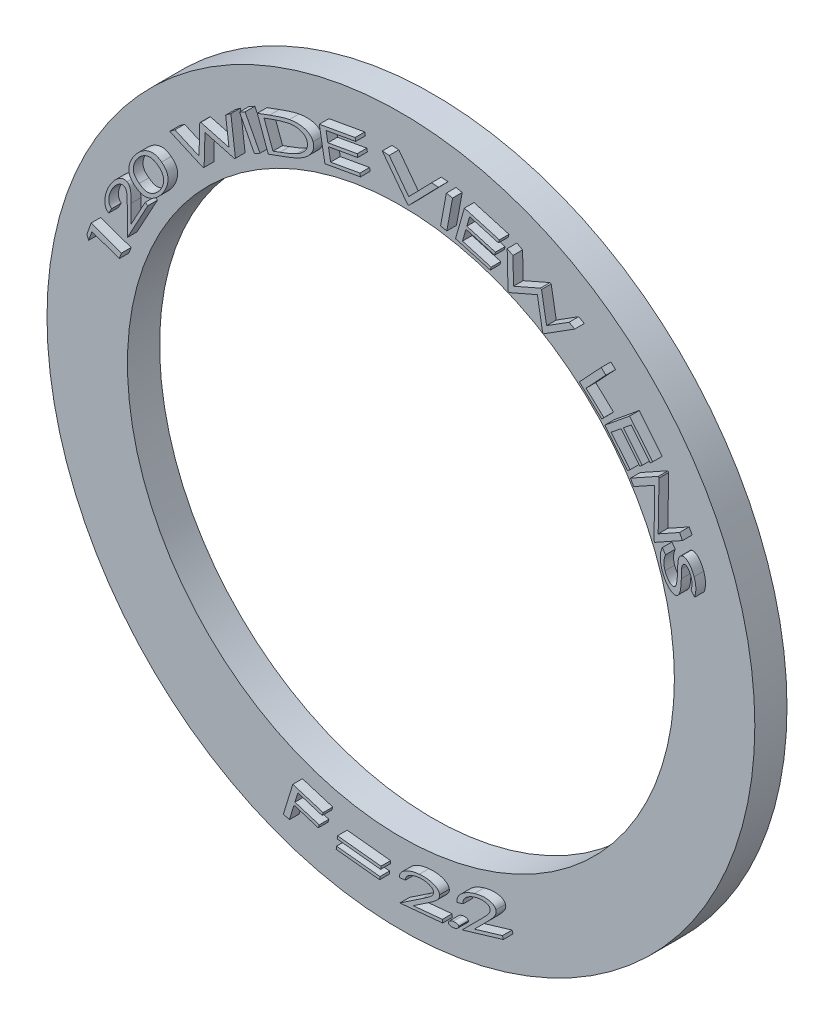
from build123d import *

# Parameters (mm, degrees)
DISC_PROFILE_R      = 11
DISC_EXTRUDE_DEPTH  = 1
LENS_HOLE_PROFILE_R = 8.5
LENS_HOLE_CUT_DEPTH = 16.588457268
LENS_TEXT_1_DEPTH   = 0.3
LENS_TEXT_2_DEPTH   = 0.3


with BuildPart() as part:
    # Disc Profile → Disc Extrude (new body)
    with BuildSketch(Plane.XY):
        Circle(DISC_PROFILE_R)
    extrude(amount=DISC_EXTRUDE_DEPTH)

    # Lens Hole Profile → Lens Hole Cut (cut, through all)
    with BuildSketch(Plane.XY.offset(1)):
        Circle(LENS_HOLE_PROFILE_R)
    extrude(amount=-LENS_HOLE_CUT_DEPTH, mode=Mode.SUBTRACT)

    # Lens Text 1 Profile → Lens Text 1 (add)
    # profile 1 of 15: a face of its own
    with BuildSketch(Plane.XY.offset(1)):
        with BuildLine():
            Line((8.423728617, 3.654576612), (8.527294322, 3.51315033))
            add(Edge.make_bspline(
                [(8.527294322, 3.51315033), (8.519780899, 3.494851602), (8.504980755, 3.458806267), (8.489407018, 3.403132009), (8.478491067, 3.347818082), (8.473602433, 3.292443154), (8.473594975, 3.237213772), (8.479720503, 3.182056578), (8.490393795, 3.126845698), (8.502132946, 3.090970139), (8.508063553, 3.072845843)],
                knots=[0, 0, 0, 0, 1.050343736, 2.068995719, 3.066212884, 4.042479059, 5.018261501, 5.995919489, 6.987540525, 8, 8, 8, 8], degree=3))
            add(Edge.make_bspline(
                [(8.508063553, 3.072845843), (8.513733128, 3.057537099), (8.524893765, 3.027401624), (8.544988036, 2.984201884), (8.566912667, 2.943195442), (8.591078398, 2.905204808), (8.616280961, 2.871097939), (8.641881761, 2.841909559), (8.667828569, 2.81831975), (8.693821097, 2.800366724), (8.719313465, 2.78769957), (8.743880411, 2.781245196), (8.767386402, 2.779236936), (8.781817692, 2.783224889), (8.788912912, 2.785185587)],
                knots=[0, 0, 0, 0, 1.353296211, 2.663982295, 3.94736361, 5.207015854, 6.394237166, 7.461098225, 8.421748881, 9.294144583, 10.074305401, 10.7673626, 11.393967334, 12, 12, 12, 12], degree=3))
            add(Edge.make_bspline(
                [(8.788912912, 2.785185587), (8.792782269, 2.78679854), (8.800574344, 2.79004669), (8.811340887, 2.797323925), (8.821404993, 2.806401989), (8.830670607, 2.817511675), (8.838839066, 2.830767879), (8.846358776, 2.845823755), (8.853527147, 2.862671994), (8.857143687, 2.874819637), (8.859025091, 2.881139112)],
                knots=[0, 0, 0, 0, 0.813988822, 1.639202765, 2.51319566, 3.444780499, 4.443274206, 5.535663917, 6.717997438, 8, 8, 8, 8], degree=3))
            add(Edge.make_bspline(
                [(8.859025091, 2.881139112), (8.861679224, 2.890994067), (8.867378796, 2.912156915), (8.873931558, 2.94671899), (8.879910185, 2.986009033), (8.885035023, 3.030112907), (8.889381802, 3.078944089), (8.892946694, 3.132577486), (8.895742833, 3.191014894), (8.896890388, 3.231630699), (8.897486629, 3.252733664)],
                knots=[0, 0, 0, 0, 0.654030667, 1.404486612, 2.253193904, 3.201411149, 4.250038705, 5.395470422, 6.646751032, 8, 8, 8, 8], degree=3))
            add(Edge.make_bspline(
                [(8.897486629, 3.252733664), (8.898139465, 3.273700775), (8.899384984, 3.313703063), (8.901390872, 3.370679555), (8.904352189, 3.421616085), (8.907112017, 3.466522038), (8.910808298, 3.505309931), (8.914435852, 3.538144969), (8.918632595, 3.564915334), (8.92231749, 3.580607064), (8.923928937, 3.58746924)],
                knots=[0, 0, 0, 0, 1.497309724, 2.856655588, 4.069078906, 5.139073161, 6.067665232, 6.849797215, 7.497002906, 8, 8, 8, 8], degree=3))
            add(Edge.make_bspline(
                [(8.923928937, 3.58746924), (8.926648496, 3.597197849), (8.931872597, 3.615885891), (8.941836528, 3.642116711), (8.953581985, 3.665213228), (8.966183163, 3.685738884), (8.980839171, 3.70287589), (8.996592339, 3.717367721), (9.013845795, 3.729117371), (9.026582678, 3.734190504), (9.032903296, 3.736708023)],
                knots=[0, 0, 0, 0, 1.259590594, 2.419593868, 3.492269597, 4.488089516, 5.4158305, 6.294262929, 7.153535963, 8, 8, 8, 8], degree=3))
            add(Edge.make_bspline(
                [(9.032903296, 3.736708023), (9.038013592, 3.738292335), (9.048232988, 3.741460588), (9.064121603, 3.744137621), (9.080328448, 3.744304119), (9.096829823, 3.743330505), (9.11356131, 3.739653173), (9.130644276, 3.734523383), (9.147965211, 3.727149883), (9.165512041, 3.717967402), (9.18309981, 3.706856956), (9.200708229, 3.694319143), (9.218099103, 3.679913965), (9.235214052, 3.663711315), (9.25222573, 3.645770497), (9.269346541, 3.626427012), (9.285914905, 3.605000209), (9.308209663, 3.574174943), (9.334653738, 3.532601932), (9.363694003, 3.479506361), (9.389958795, 3.422776834), (9.404633132, 3.383117329), (9.412110027, 3.362909946)],
                knots=[0, 0, 0, 0, 0.554757302, 1.10938483, 1.663752722, 2.23332095, 2.820234497, 3.435997283, 4.081848178, 4.769725298, 5.488611413, 6.238344157, 7.01090061, 7.829305935, 8.681858928, 9.575309961, 10.507944328, 11.490419604, 13.521623158, 15.614235795, 17.765357483, 20, 20, 20, 20], degree=3))
            add(Edge.make_bspline(
                [(9.412110027, 3.362909946), (9.419373553, 3.341169804), (9.433675819, 3.298362318), (9.449356178, 3.233351018), (9.460519098, 3.169196398), (9.465719706, 3.115812635), (9.467011163, 3.072920849), (9.466726555, 3.039823105), (9.464337477, 3.005752074), (9.460797487, 2.970658746), (9.455562488, 2.934571174), (9.448604765, 2.897466662), (9.440611373, 2.859234184), (9.433797366, 2.83363443), (9.430339194, 2.820642317)],
                knots=[0, 0, 0, 0, 1.49420363, 2.942165765, 4.356038615, 5.738248546, 6.435309068, 7.15385477, 7.895668277, 8.661726644, 9.453671682, 10.272746552, 11.123402835, 12, 12, 12, 12], degree=3))
            Line((9.430339194, 2.820642317), (9.318760668, 2.952052574))
            add(Edge.make_bspline(
                [(9.318760668, 2.952052574), (9.321340987, 2.962592589), (9.326375527, 2.983157538), (9.333005538, 3.013331208), (9.338432766, 3.041986369), (9.342712075, 3.0691033), (9.34567307, 3.094773919), (9.347760768, 3.118951109), (9.348623722, 3.141685273), (9.347999157, 3.170118445), (9.34519522, 3.205086465), (9.337907387, 3.247071222), (9.327883963, 3.289856043), (9.318515181, 3.318102452), (9.313752655, 3.332461228)],
                knots=[0, 0, 0, 0, 1.008995287, 1.968681945, 2.872256212, 3.720551418, 4.520741427, 5.274591281, 5.976647269, 6.634917989, 7.91831912, 9.234069694, 10.5939674, 12, 12, 12, 12], degree=3))
            add(Edge.make_bspline(
                [(9.313752655, 3.332461228), (9.310418146, 3.341569259), (9.3038943, 3.359388788), (9.293113982, 3.385113297), (9.281399731, 3.409068378), (9.269550683, 3.431642767), (9.256656122, 3.45220338), (9.243370226, 3.47126185), (9.229440596, 3.48865128), (9.214872432, 3.504217554), (9.200210302, 3.517753494), (9.185774153, 3.529067113), (9.171641221, 3.538136367), (9.157604354, 3.544571033), (9.143849347, 3.548731587), (9.130373178, 3.55039123), (9.117085033, 3.549698235), (9.1086583, 3.547239967), (9.104417719, 3.546002894)],
                knots=[0, 0, 0, 0, 1.435482317, 2.808468448, 4.125687118, 5.381407866, 6.579858115, 7.714980837, 8.818559533, 9.874373503, 10.867599738, 11.769065339, 12.586190385, 13.346858164, 14.047364893, 14.704415211, 15.348023505, 16, 16, 16, 16], degree=3))
            add(Edge.make_bspline(
                [(9.104417719, 3.546002894), (9.099427691, 3.543870818), (9.089333962, 3.539558097), (9.07597256, 3.529040142), (9.063786522, 3.515849774), (9.052994555, 3.499056457), (9.043430578, 3.478075178), (9.035761878, 3.45185978), (9.028772305, 3.420478153), (9.025461037, 3.397594961), (9.023688553, 3.385345843)],
                knots=[0, 0, 0, 0, 0.687151758, 1.389956767, 2.140786767, 2.962403431, 3.915657443, 5.062024679, 6.427334552, 8, 8, 8, 8], degree=3))
            add(Edge.make_bspline(
                [(9.023688553, 3.385345843), (9.023264031, 3.380807074), (9.022235133, 3.369806616), (9.021159793, 3.350295709), (9.019895582, 3.324925987), (9.019086135, 3.293663246), (9.017697936, 3.2566136), (9.016905919, 3.213668704), (9.015528799, 3.16486443), (9.014969465, 3.130338696), (9.014674129, 3.112108664)],
                knots=[0, 0, 0, 0, 0.400098844, 0.969705846, 1.714887566, 2.629678589, 3.714540235, 4.969144096, 6.399669019, 8, 8, 8, 8], degree=3))
            add(Edge.make_bspline(
                [(9.014674129, 3.112108664), (9.014155354, 3.090137688), (9.01315847, 3.047918031), (9.010404575, 2.986998917), (9.006437063, 2.931092373), (9.001468754, 2.880053734), (8.995597605, 2.834063692), (8.988566695, 2.79296552), (8.980846666, 2.756762828), (8.971510938, 2.725204155), (8.961106653, 2.697661079), (8.950261117, 2.672989595), (8.937956337, 2.651364834), (8.925023423, 2.632224441), (8.910648844, 2.616103849), (8.895467763, 2.602510942), (8.879063, 2.591788728), (8.867260777, 2.587020755), (8.861428937, 2.584664753)],
                knots=[0, 0, 0, 0, 1.834631967, 3.525447918, 5.090229516, 6.51294426, 7.805894345, 8.959667477, 9.992960552, 10.894223921, 11.703880731, 12.449859195, 13.14127511, 13.778332908, 14.374574975, 14.939342997, 15.475896869, 16, 16, 16, 16], degree=3))
            add(Edge.make_bspline(
                [(8.861428937, 2.584664753), (8.852814078, 2.582170223), (8.835629175, 2.577194139), (8.808229451, 2.576119065), (8.78011308, 2.579655736), (8.751389165, 2.589257818), (8.721734688, 2.603086598), (8.691619926, 2.622675924), (8.66031872, 2.646684505), (8.62891539, 2.675864595), (8.597742958, 2.708859676), (8.567701751, 2.745083467), (8.539461917, 2.7843152), (8.512747489, 2.826301751), (8.487712182, 2.871271466), (8.464364261, 2.919197433), (8.442421266, 2.969906688), (8.429501953, 3.00507098), (8.422927335, 3.022966035)],
                knots=[0, 0, 0, 0, 0.640520114, 1.277708174, 1.948273853, 2.660936783, 3.437846171, 4.287306012, 5.228919543, 6.261667353, 7.354796198, 8.479465068, 9.630734802, 10.815939505, 12.043185296, 13.31628554, 14.63426178, 16, 16, 16, 16], degree=3))
            add(Edge.make_bspline(
                [(8.422927335, 3.022966035), (8.418138545, 3.036951983), (8.408660462, 3.064633293), (8.396582152, 3.106390969), (8.385799579, 3.147545513), (8.377315065, 3.188301305), (8.370173048, 3.228426531), (8.36496903, 3.268131146), (8.36156055, 3.307364733), (8.359894547, 3.346199114), (8.360243547, 3.38485594), (8.362922291, 3.423431421), (8.367474639, 3.462030944), (8.374361787, 3.500606496), (8.383324903, 3.539207497), (8.394671411, 3.577820962), (8.40798539, 3.616421513), (8.418459087, 3.641805443), (8.423728617, 3.654576612)],
                knots=[0, 0, 0, 0, 1.095120058, 2.167486731, 3.219809554, 4.246384404, 5.250870721, 6.238835059, 7.212136192, 8.167774999, 9.117698173, 10.074680634, 11.031343349, 11.995993307, 12.976422561, 13.965872187, 14.976589048, 16, 16, 16, 16], degree=3))
        make_face()
    # profile 2 of 15: a face of its own
    with BuildSketch(Plane.XY.offset(1)):
        Polygon((7.435023779, 5.028468122), (8.300608715, 5.510238956), (8.321442048, 5.47277902), (8.296001343, 3.959157225), (8.958661599, 4.327947289), (9.053012561, 4.158275815), (8.187427625, 3.676504981), (8.16599333, 3.71496652), (8.188629548, 5.214766199), (7.534182433, 4.850583507), align=None)
    # profile 3 of 15: a face of its own
    with BuildSketch(Plane.XY.offset(1)):
        Polygon((7.408972434, 6.686476), (8.123315382, 5.810474398), (8.047193588, 5.748375039), (7.457249677, 6.47173241), (7.215262498, 6.274416705), (7.800198395, 5.557269269), (7.724477241, 5.495370231), (7.139541344, 6.212517667), (6.836256088, 5.965322154), (7.421191985, 5.248174718), (7.34486987, 5.185875039), (6.635534934, 6.055666705), align=None)
    # profile 4 of 15: a face of its own
    with BuildSketch(Plane.XY.offset(1)):
        Polygon((6.52583235, 7.553207232), (6.670263439, 7.417990886), (6.055079145, 6.760739284), (6.606962157, 6.244313002), (6.541257029, 6.174000502), (5.844942927, 6.82564313), align=None)
    # profile 5 of 15: a face of its own
    with BuildSketch(Plane.XY.offset(1)):
        Polygon((3.603006327, 9.290960733), (3.781692224, 9.19600881), (3.800322032, 8.377499194), (4.634656968, 8.742483169), (4.670113698, 8.72365304), (4.828366904, 7.830824515), (5.524480686, 8.269326117), (5.70196466, 8.174975156), (4.737421391, 7.565600156), (4.704368506, 7.583228361), (4.540506327, 8.519326117), (3.661900557, 8.13751522), (3.628847673, 8.155143425), align=None)
    # profile 6 of 15: a face of its own
    with BuildSketch(Plane.XY.offset(1)):
        Polygon((2.272601091, 9.716303015), (3.359740514, 9.404403976), (3.332697245, 9.310053015), (2.435061027, 9.567464874), (2.349123527, 9.267985707), (3.238947245, 9.012777374), (3.212104296, 8.919027374), (2.322280578, 9.174235707), (2.214508142, 8.798434425), (3.10433186, 8.543226092), (3.077288591, 8.44887513), (1.997961668, 8.758570643), align=None)
    # profile 7 of 15: a face of its own
    with BuildSketch(Plane.XY.offset(1)):
        Polygon((1.711622493, 9.840039634), (1.90573307, 9.804382582), (1.726446211, 8.828220723), (1.532335634, 8.863877775), align=None)
    # profile 8 of 15: a face of its own
    with BuildSketch(Plane.XY.offset(1)):
        Polygon((-0.278983953, 9.979008511), (-0.064641004, 9.966388319), (0.542129829, 9.158696011), (1.252266047, 9.888062998), (1.466608996, 9.875442806), (0.55014265, 8.93173287), (0.50727406, 8.934337037), align=None)
    # profile 9 of 15: a face of its own
    with BuildSketch(Plane.XY.offset(1)):
        Polygon((-2.236266899, 9.719534125), (-1.122885489, 9.917851433), (-1.105858245, 9.821497266), (-2.025129078, 9.657835407), (-1.970641899, 9.352747266), (-1.059183566, 9.515207202), (-1.042156322, 9.419654317), (-1.953614655, 9.257194381), (-1.885505681, 8.874181561), (-0.974047348, 9.036641497), (-0.956819784, 8.940487651), (-2.062388694, 8.743372266), align=None)
    # profile 10 of 15: a face of its own
    with BuildSketch(Plane.XY.offset(1)):
        with BuildLine():
            Line((-3.822495702, 8.121370429), (-4.164643138, 9.05145857))
            Line((-4.164643138, 9.05145857), (-3.780829035, 9.192484211))
            add(Edge.make_bspline(
                [(-3.780829035, 9.192484211), (-3.76380254, 9.198696053), (-3.730365855, 9.210894888), (-3.681025152, 9.228858854), (-3.633301446, 9.24555619), (-3.587236568, 9.261475926), (-3.542964776, 9.276433874), (-3.500296853, 9.290527707), (-3.459375287, 9.30371956), (-3.420061469, 9.315999122), (-3.382425694, 9.32715036), (-3.346505131, 9.337578275), (-3.312386078, 9.347328854), (-3.279763527, 9.355554625), (-3.249020955, 9.363613357), (-3.219763982, 9.370053068), (-3.192273811, 9.375972994), (-3.174465794, 9.379350693), (-3.165845061, 9.380985813)],
                knots=[0, 0, 0, 0, 1.351093861, 2.653282428, 3.914291183, 5.120106647, 6.28651377, 7.397822791, 8.469831837, 9.491618435, 10.468059256, 11.395902381, 12.279986648, 13.113033533, 13.903798207, 14.648874714, 15.345929948, 16, 16, 16, 16], degree=3))
            add(Edge.make_bspline(
                [(-3.165845061, 9.380985813), (-3.142438376, 9.384872905), (-3.096754286, 9.392459552), (-3.029295158, 9.399983782), (-2.964728087, 9.40445554), (-2.90298578, 9.404797466), (-2.844119392, 9.40188085), (-2.788142471, 9.395601327), (-2.735024257, 9.385616523), (-2.685062948, 9.372055606), (-2.638475074, 9.355361363), (-2.595893286, 9.335389035), (-2.557365846, 9.31224691), (-2.523178419, 9.285777573), (-2.493248675, 9.256092096), (-2.467525593, 9.223321702), (-2.446028518, 9.187303837), (-2.43541983, 9.161321362), (-2.430067817, 9.148213377)],
                knots=[0, 0, 0, 0, 1.360310051, 2.654990504, 3.890485538, 5.069783015, 6.193092666, 7.268333257, 8.297107459, 9.289086306, 10.233801323, 11.131278956, 11.98162764, 12.805702231, 13.6043826, 14.392531192, 15.189042729, 16, 16, 16, 16], degree=3))
            add(Edge.make_bspline(
                [(-2.430067817, 9.148213377), (-2.426175793, 9.136606626), (-2.418457453, 9.113589083), (-2.411984071, 9.077881985), (-2.409569462, 9.04193608), (-2.41116439, 9.005639907), (-2.417073188, 8.968963276), (-2.427233071, 8.932026143), (-2.441364786, 8.894726856), (-2.45967108, 8.857540844), (-2.481283324, 8.820554183), (-2.506050292, 8.784321122), (-2.533398641, 8.748747157), (-2.564173225, 8.714526265), (-2.597268963, 8.6808209), (-2.633571459, 8.64831146), (-2.67268762, 8.61672272), (-2.714926518, 8.585505476), (-2.761396143, 8.554885525), (-2.812957851, 8.524438282), (-2.869804194, 8.493739162), (-2.931992195, 8.462573548), (-2.999790341, 8.431806232), (-3.072726379, 8.4001688), (-3.15127876, 8.368917635), (-3.205608892, 8.348446272), (-3.233553394, 8.337916903)],
                knots=[0, 0, 0, 0, 0.702374227, 1.392890111, 2.077093527, 2.768099146, 3.474898874, 4.206153474, 4.964744567, 5.7623234, 6.583875029, 7.423147508, 8.281549582, 9.158991071, 10.064765006, 10.993501169, 11.956028169, 12.951664754, 14.008966109, 15.150780303, 16.389783899, 17.719005114, 19.145082112, 20.665387545, 22.284854413, 24, 24, 24, 24], degree=3))
            Line((-3.233553394, 8.337916903), (-3.822495702, 8.121370429))
        make_face()
        with BuildLine():
            Line((-3.67726333, 8.274615621), (-3.463321023, 8.353141262))
            add(Edge.make_bspline(
                [(-3.463321023, 8.353141262), (-3.447626439, 8.358942992), (-3.416889804, 8.370305234), (-3.371730334, 8.387144687), (-3.328503699, 8.403510962), (-3.287284107, 8.419591303), (-3.247912237, 8.434977467), (-3.210507795, 8.450074463), (-3.174840344, 8.464376769), (-3.141237247, 8.478458576), (-3.109485132, 8.491866985), (-3.079629204, 8.504875511), (-3.051681374, 8.517498581), (-3.025566673, 8.529435099), (-3.001544559, 8.541164846), (-2.979274542, 8.552053325), (-2.95903807, 8.562735332), (-2.946219254, 8.569740387), (-2.940083843, 8.573093185)],
                knots=[0, 0, 0, 0, 1.413915648, 2.769045203, 4.072673297, 5.319581463, 6.507773825, 7.644603365, 8.728004325, 9.754922439, 10.72326539, 11.640499384, 12.506732943, 13.314602712, 14.066632094, 14.765607707, 15.4091885, 16, 16, 16, 16], degree=3))
            add(Edge.make_bspline(
                [(-2.940083843, 8.573093185), (-2.924248691, 8.582314302), (-2.893271474, 8.600352938), (-2.849166067, 8.628926372), (-2.808557724, 8.658478247), (-2.771359355, 8.688614042), (-2.737463899, 8.719331544), (-2.707095228, 8.75081501), (-2.680208835, 8.783105896), (-2.656666195, 8.815879611), (-2.637008751, 8.84902325), (-2.621380652, 8.882196732), (-2.610096859, 8.915265497), (-2.602621812, 8.948150548), (-2.5998274, 8.981044756), (-2.601347234, 9.013720489), (-2.606541417, 9.046409185), (-2.61358952, 9.067430606), (-2.617167176, 9.078101198)],
                knots=[0, 0, 0, 0, 1.349010385, 2.638976074, 3.867169785, 5.044976259, 6.162078749, 7.232975125, 8.262763069, 9.253166453, 10.200858406, 11.096011479, 11.947975919, 12.768627601, 13.572918148, 14.370085329, 15.172646136, 16, 16, 16, 16], degree=3))
            add(Edge.make_bspline(
                [(-2.617167176, 9.078101198), (-2.621645223, 9.088975978), (-2.630505264, 9.110492279), (-2.648337049, 9.140428559), (-2.670041643, 9.167435817), (-2.695158973, 9.191901838), (-2.724246684, 9.213079149), (-2.756463356, 9.232140073), (-2.792551234, 9.248056558), (-2.832027749, 9.261138287), (-2.874437006, 9.271492545), (-2.919509335, 9.278850525), (-2.967031249, 9.28324848), (-3.017017545, 9.284305612), (-3.069447161, 9.282455901), (-3.124388899, 9.27751651), (-3.18191476, 9.269830965), (-3.220833991, 9.262264516), (-3.240764933, 9.258389659)],
                knots=[0, 0, 0, 0, 0.799078423, 1.581016933, 2.359744399, 3.149790465, 3.958144772, 4.800860793, 5.691234321, 6.634731864, 7.626013907, 8.657036478, 9.737938569, 10.869036727, 12.055006052, 13.304071249, 14.619386931, 16, 16, 16, 16], degree=3))
            add(Edge.make_bspline(
                [(-3.240764933, 9.258389659), (-3.24872068, 9.256764431), (-3.265214309, 9.253395054), (-3.290622234, 9.247282136), (-3.317723737, 9.240435033), (-3.34655154, 9.232921263), (-3.376977274, 9.224114988), (-3.409255449, 9.215085877), (-3.443110806, 9.204708576), (-3.478760201, 9.193810679), (-3.515974749, 9.181710066), (-3.554898143, 9.168871956), (-3.59550153, 9.155263911), (-3.637811275, 9.140892532), (-3.68168805, 9.125359691), (-3.727316934, 9.109196808), (-3.774642567, 9.092121553), (-3.806739812, 9.080445553), (-3.823096664, 9.074495429)],
                knots=[0, 0, 0, 0, 0.637713992, 1.322090618, 2.052201272, 2.833255821, 3.661697573, 4.539842842, 5.465634486, 6.442695413, 7.467661598, 8.539021023, 9.661788276, 10.831020119, 12.048480079, 13.317432972, 14.632955844, 16, 16, 16, 16], degree=3))
            Line((-3.823096664, 9.074495429), (-3.953905958, 9.026418506))
            Line((-3.953905958, 9.026418506), (-3.67726333, 8.274615621))
        make_face(mode=Mode.SUBTRACT)
    # profile 11 of 15: a face of its own
    with BuildSketch(Plane.XY.offset(1)):
        Polygon((-4.717708646, 8.808765598), (-4.542828838, 8.900312072), (-4.080689415, 8.016297649), (-4.255569223, 7.924751175), align=None)
    # profile 12 of 15: a face of its own
    with BuildSketch(Plane.XY.offset(1)):
        Polygon((-6.885292255, 7.203471438), (-6.723633601, 7.324865669), (-5.975035844, 6.994737464), (-5.951798665, 7.904392912), (-5.919747383, 7.928431374), (-5.044947703, 7.693054771), (-5.146910844, 8.508559579), (-4.986253793, 8.629352848), (-4.843224947, 7.498343233), (-4.873273024, 7.475707015), (-5.789939691, 7.724505092), (-5.816381998, 6.767574002), (-5.846229755, 6.745138105), align=None)
    # profile 13 of 15: a face of its own
    with BuildSketch(Plane.XY.offset(1)):
        with BuildLine():
            add(Edge.make_bspline(
                [(-7.948676591, 5.18145406), (-7.961237569, 5.191234542), (-7.985700441, 5.210282315), (-8.019040803, 5.240867134), (-8.049021192, 5.271476553), (-8.07480335, 5.302848605), (-8.097346874, 5.334229355), (-8.115598256, 5.366335524), (-8.13049662, 5.398606946), (-8.141096439, 5.431634363), (-8.148373645, 5.465156635), (-8.153526957, 5.49920743), (-8.155646944, 5.534055396), (-8.15517046, 5.569593818), (-8.152388881, 5.605871926), (-8.146971103, 5.642900494), (-8.138614694, 5.680511447), (-8.128004343, 5.718765191), (-8.115037969, 5.757288195), (-8.099636219, 5.795738306), (-8.082723184, 5.834285435), (-8.063437599, 5.872581419), (-8.04190457, 5.910553378), (-8.018700837, 5.948557735), (-7.99318469, 5.986240455), (-7.974940161, 6.010911443), (-7.965703835, 6.023401176)],
                knots=[0, 0, 0, 0, 1.194917298, 2.327136279, 3.394436398, 4.409387757, 5.373438459, 6.291980559, 7.178320174, 8.037702193, 8.890432765, 9.751962166, 10.621117477, 11.50863337, 12.418858844, 13.351294859, 14.3160624, 15.309901695, 16.330989552, 17.366331351, 18.41911777, 19.490930706, 20.584247058, 21.696122571, 22.833657891, 24, 24, 24, 24], degree=3))
            add(Edge.make_bspline(
                [(-7.965703835, 6.023401176), (-7.956052487, 6.035833175), (-7.93698864, 6.060389512), (-7.906983439, 6.095483304), (-7.876483457, 6.128797621), (-7.844886647, 6.159829765), (-7.812820195, 6.18910211), (-7.780262375, 6.21668321), (-7.746625173, 6.241901301), (-7.712580128, 6.265335724), (-7.677962904, 6.286389947), (-7.643092969, 6.304809012), (-7.608185514, 6.320801529), (-7.57300411, 6.333823238), (-7.537672441, 6.344277828), (-7.502147723, 6.352200931), (-7.466434622, 6.357108107), (-7.430623656, 6.359697757), (-7.394527492, 6.35892745), (-7.358230989, 6.354479551), (-7.321674732, 6.346367584), (-7.284976644, 6.334527006), (-7.248261316, 6.318661389), (-7.21121112, 6.299521329), (-7.173883185, 6.276757745), (-7.149868455, 6.259033909), (-7.137578835, 6.249963676)],
                knots=[0, 0, 0, 0, 1.166318929, 2.303774233, 3.421014271, 4.512854258, 5.584795463, 6.638555334, 7.673873759, 8.699268111, 9.700785835, 10.674856097, 11.620566187, 12.544438321, 13.452669732, 14.34964024, 15.239194072, 16.122101461, 17.008179382, 17.91052652, 18.82789407, 19.779451933, 20.763938884, 21.78874788, 22.868384121, 24, 24, 24, 24], degree=3))
            add(Edge.make_bspline(
                [(-7.137578835, 6.249963676), (-7.125618477, 6.240582756), (-7.102276301, 6.222274686), (-7.070409734, 6.192610754), (-7.041762033, 6.162509745), (-7.017115944, 6.131255599), (-6.99557222, 6.09954736), (-6.977972851, 6.066816345), (-6.963731311, 6.033391026), (-6.953439886, 5.999133293), (-6.945942882, 5.96428848), (-6.94150045, 5.928760244), (-6.939142896, 5.892625979), (-6.939870393, 5.855797951), (-6.943098404, 5.818327995), (-6.948876043, 5.780158921), (-6.957674593, 5.741492895), (-6.968605615, 5.702277523), (-6.98216253, 5.662919415), (-6.9974342, 5.623451327), (-7.015272799, 5.584326449), (-7.034796453, 5.545301154), (-7.056535715, 5.506581131), (-7.080255293, 5.468022909), (-7.105967623, 5.429599846), (-7.124583339, 5.404600523), (-7.133973065, 5.391990919)],
                knots=[0, 0, 0, 0, 1.126556296, 2.198619474, 3.224832851, 4.204476961, 5.146441489, 6.063526528, 6.955450344, 7.835589394, 8.711457186, 9.595125977, 10.48794248, 11.394070797, 12.323263444, 13.274819959, 14.25376325, 15.261612036, 16.291794567, 17.338967833, 18.398138574, 19.47861674, 20.573562014, 21.689296403, 22.83448614, 24, 24, 24, 24], degree=3))
            add(Edge.make_bspline(
                [(-7.133973065, 5.391990919), (-7.143504999, 5.379771372), (-7.162361133, 5.355598582), (-7.191797109, 5.32088991), (-7.222067059, 5.288333533), (-7.252728827, 5.257511704), (-7.284197227, 5.228806279), (-7.31651232, 5.202275176), (-7.349153163, 5.177242642), (-7.38247045, 5.154530256), (-7.416110276, 5.13402745), (-7.449960782, 5.1160703), (-7.484133872, 5.101139918), (-7.518161374, 5.088359906), (-7.552374408, 5.078449096), (-7.58670731, 5.071555212), (-7.621082569, 5.066793165), (-7.655663777, 5.064929068), (-7.690620865, 5.066311727), (-7.726097038, 5.071307446), (-7.761994127, 5.080507862), (-7.798447247, 5.093321154), (-7.835607028, 5.109485954), (-7.872995995, 5.129966585), (-7.911102559, 5.153868775), (-7.935902113, 5.172075573), (-7.948676591, 5.18145406)],
                knots=[0, 0, 0, 0, 1.165492818, 2.30558563, 3.421441212, 4.508074127, 5.574559904, 6.623303858, 7.651832823, 8.667282552, 9.654306155, 10.61352068, 11.546653083, 12.457131537, 13.345627652, 14.222192692, 15.08868726, 15.953652397, 16.823168751, 17.715912545, 18.64282133, 19.605290642, 20.619510208, 21.68684698, 22.808473724, 24, 24, 24, 24], degree=3))
        make_face()
        with BuildLine():
            add(Edge.make_bspline(
                [(-7.834694219, 5.328288996), (-7.823743068, 5.320250103), (-7.802489911, 5.304648834), (-7.770475722, 5.283476773), (-7.739174684, 5.265649642), (-7.708859647, 5.250645328), (-7.679390858, 5.238802471), (-7.650899324, 5.229777965), (-7.623222743, 5.224185223), (-7.596319129, 5.22119531), (-7.569898898, 5.221453247), (-7.543615664, 5.22330078), (-7.517302754, 5.227845196), (-7.490938459, 5.234460306), (-7.464544234, 5.2431169), (-7.438146967, 5.253996502), (-7.411810393, 5.26730437), (-7.376498857, 5.287609602), (-7.334100991, 5.317240659), (-7.286076827, 5.357124111), (-7.241360551, 5.401736066), (-7.214995715, 5.434792513), (-7.201681399, 5.451486111)],
                knots=[0, 0, 0, 0, 1.103643259, 2.141866639, 3.116214363, 4.028474408, 4.887789262, 5.694277661, 6.452870412, 7.17838552, 7.889064194, 8.596401313, 9.317032112, 10.055174913, 10.803160185, 11.571850479, 12.372478758, 13.198794413, 14.879686631, 16.566879077, 18.266264243, 20, 20, 20, 20], degree=3))
            add(Edge.make_bspline(
                [(-7.201681399, 5.451486111), (-7.195273244, 5.46018721), (-7.182527807, 5.477493179), (-7.16469079, 5.504081471), (-7.148389684, 5.531233178), (-7.133713492, 5.558788847), (-7.120101642, 5.586575241), (-7.108133044, 5.614816974), (-7.097497595, 5.64349138), (-7.088312084, 5.672343762), (-7.080784607, 5.701123151), (-7.075626377, 5.729594993), (-7.072368593, 5.75756314), (-7.071101335, 5.784946637), (-7.07207915, 5.811822209), (-7.0753668, 5.838058797), (-7.080431433, 5.863915019), (-7.085672426, 5.880614071), (-7.088299988, 5.888986111)],
                knots=[0, 0, 0, 0, 1.104469853, 2.196724934, 3.271264737, 4.340023078, 5.387050201, 6.432919895, 7.473811408, 8.512081503, 9.526844317, 10.512143544, 11.467119318, 12.40307644, 13.311477442, 14.212230947, 15.103705186, 16, 16, 16, 16], degree=3))
            add(Edge.make_bspline(
                [(-7.088299988, 5.888986111), (-7.091859846, 5.899074606), (-7.09901005, 5.919337998), (-7.113006294, 5.948444398), (-7.129109063, 5.976758126), (-7.147725405, 6.004021891), (-7.16910644, 6.030095393), (-7.192901068, 6.055151723), (-7.2188232, 6.079521303), (-7.237754232, 6.094387778), (-7.247354476, 6.101926817)],
                knots=[0, 0, 0, 0, 0.950533069, 1.909206989, 2.866464479, 3.844572955, 4.840375603, 5.860876741, 6.915214665, 8, 8, 8, 8], degree=3))
            add(Edge.make_bspline(
                [(-7.247354476, 6.101926817), (-7.257212401, 6.109203042), (-7.276463665, 6.123412575), (-7.30629152, 6.142084958), (-7.335936803, 6.158130882), (-7.365440757, 6.171735379), (-7.394964649, 6.18232373), (-7.424289104, 6.190422226), (-7.45350258, 6.195876565), (-7.48259979, 6.198751968), (-7.511468812, 6.198751152), (-7.540025277, 6.197156416), (-7.568173898, 6.192726819), (-7.596104288, 6.186684477), (-7.62364236, 6.177896481), (-7.650905481, 6.16709894), (-7.677821851, 6.154035439), (-7.712999332, 6.133573417), (-7.755344651, 6.104532236), (-7.802854618, 6.064732439), (-7.847187672, 6.02056705), (-7.873389503, 5.987806608), (-7.886577232, 5.971317842)],
                knots=[0, 0, 0, 0, 0.993337197, 1.939860028, 2.850880365, 3.725678358, 4.571851446, 5.391586621, 6.190268307, 6.97910497, 7.758894012, 8.529377001, 9.295968252, 10.067154991, 10.844703391, 11.637082071, 12.443564157, 13.268363216, 14.935572067, 16.600255117, 18.288863233, 20, 20, 20, 20], degree=3))
            add(Edge.make_bspline(
                [(-7.886577232, 5.971317842), (-7.892998437, 5.962625699), (-7.90574785, 5.945367299), (-7.923406446, 5.918631973), (-7.939603285, 5.891401324), (-7.954474766, 5.863743651), (-7.967846455, 5.835613083), (-7.98018512, 5.807238481), (-7.990777012, 5.778245881), (-7.999962604, 5.749058863), (-8.007429157, 5.719852538), (-8.012804336, 5.691075973), (-8.016357108, 5.662850291), (-8.017506125, 5.635185048), (-8.016723221, 5.608072025), (-8.013996844, 5.581521595), (-8.008888774, 5.555621447), (-8.001912137, 5.530081959), (-7.992230685, 5.504767066), (-7.979233006, 5.479542481), (-7.962879817, 5.454400022), (-7.943571865, 5.429049053), (-7.920942358, 5.403802347), (-7.89526704, 5.378377216), (-7.866377187, 5.352883641), (-7.845471054, 5.336654766), (-7.834694219, 5.328288996)],
                knots=[0, 0, 0, 0, 1.053246453, 2.091238962, 3.12153009, 4.14072127, 5.150915328, 6.156822828, 7.155545183, 8.158077853, 9.138390974, 10.091979178, 11.009892974, 11.908944555, 12.788007037, 13.651976467, 14.50722294, 15.358373084, 16.229885256, 17.143914077, 18.118853917, 19.149864357, 20.247119084, 21.420729474, 22.670420188, 24, 24, 24, 24], degree=3))
        make_face(mode=Mode.SUBTRACT)
    # profile 14 of 15: a face of its own
    with BuildSketch(Plane.XY.offset(1)):
        with BuildLine():
            Line((-8.691121787, 4.220128151), (-8.781266018, 4.054262767))
            add(Edge.make_bspline(
                [(-8.781266018, 4.054262767), (-8.791352353, 4.061073121), (-8.811402541, 4.074611127), (-8.8367274, 4.100929036), (-8.858316274, 4.130856588), (-8.875265357, 4.165186757), (-8.888367951, 4.203412204), (-8.896935347, 4.245767296), (-8.901699236, 4.29211922), (-8.902045075, 4.342045981), (-8.898671108, 4.394538364), (-8.891133258, 4.448463263), (-8.879869808, 4.503407757), (-8.864506621, 4.559283057), (-8.845464465, 4.616293539), (-8.82228749, 4.674128565), (-8.795446088, 4.733080559), (-8.774921672, 4.771977031), (-8.764439095, 4.791842895)],
                knots=[0, 0, 0, 0, 0.726858, 1.444889453, 2.172648376, 2.928902692, 3.72790482, 4.585653538, 5.510119115, 6.513615996, 7.571197315, 8.656706253, 9.770805705, 10.926807686, 12.123993351, 13.367441832, 14.655455358, 16, 16, 16, 16], degree=3))
            add(Edge.make_bspline(
                [(-8.764439095, 4.791842895), (-8.753689018, 4.811191792), (-8.732716772, 4.848939416), (-8.698630827, 4.902268619), (-8.664012465, 4.951649777), (-8.628694016, 4.997076437), (-8.592142763, 5.038022762), (-8.55479628, 5.074893542), (-8.516563282, 5.107652162), (-8.477701446, 5.13592806), (-8.439373818, 5.159735315), (-8.402188765, 5.178578529), (-8.366590608, 5.19243457), (-8.332590822, 5.201340213), (-8.300028398, 5.204932111), (-8.269127665, 5.203362456), (-8.239562387, 5.196975852), (-8.221702061, 5.18837723), (-8.212756403, 5.184070459)],
                knots=[0, 0, 0, 0, 1.445323639, 2.819671403, 4.131198069, 5.383074969, 6.57530866, 7.713225605, 8.808259064, 9.860233753, 10.84903418, 11.752021903, 12.578920797, 13.339410002, 14.041095469, 14.709238039, 15.353499228, 16, 16, 16, 16], degree=3))
            add(Edge.make_bspline(
                [(-8.212756403, 5.184070459), (-8.206729283, 5.180458721), (-8.194704552, 5.173252928), (-8.178115027, 5.160109932), (-8.163199583, 5.144687704), (-8.14982975, 5.127239264), (-8.137887141, 5.107768356), (-8.127553517, 5.086250887), (-8.118488365, 5.062761548), (-8.111052104, 5.036654625), (-8.104558714, 5.00716615), (-8.099397892, 4.973145287), (-8.094513785, 4.934354144), (-8.090876173, 4.890573092), (-8.087890146, 4.84188372), (-8.085751591, 4.788185198), (-8.084348656, 4.729550429), (-8.084086521, 4.688812235), (-8.083950313, 4.667644177)],
                knots=[0, 0, 0, 0, 0.607228555, 1.21148426, 1.824043921, 2.458163512, 3.108868434, 3.795870091, 4.519767306, 5.283651876, 6.141139737, 7.1294498, 8.258292466, 9.521961309, 10.927897626, 12.476834932, 14.169320826, 16, 16, 16, 16], degree=3))
            Line((-8.083950313, 4.667644177), (-8.083149031, 4.109350908))
            Line((-8.083149031, 4.109350908), (-7.6492548, 4.908629754))
            Line((-7.6492548, 4.908629754), (-7.564719544, 4.862756357))
            Line((-7.564719544, 4.862756357), (-8.203141018, 3.686874946))
            Line((-8.203141018, 3.686874946), (-8.204943903, 4.544246741))
            add(Edge.make_bspline(
                [(-8.204943903, 4.544246741), (-8.204964039, 4.565080309), (-8.205002569, 4.604946317), (-8.205791544, 4.66204264), (-8.207174358, 4.713730125), (-8.20905506, 4.760089695), (-8.211858529, 4.801097186), (-8.215159543, 4.83678289), (-8.219109672, 4.867127811), (-8.223600158, 4.892805618), (-8.229457892, 4.914833569), (-8.235910734, 4.934639209), (-8.243983536, 4.952518907), (-8.253171596, 4.968676315), (-8.263647129, 4.982942309), (-8.275129413, 4.995589703), (-8.288004403, 5.006340814), (-8.297542565, 5.011984746), (-8.302299672, 5.014799626)],
                knots=[0, 0, 0, 0, 2.003288687, 3.833386678, 5.490553426, 6.975139057, 8.294461565, 9.442558103, 10.420560831, 11.236629591, 11.946784677, 12.610736392, 13.237246377, 13.829768459, 14.394832179, 14.935588611, 15.469130541, 16, 16, 16, 16], degree=3))
            add(Edge.make_bspline(
                [(-8.302299672, 5.014799626), (-8.308545597, 5.017804327), (-8.321031319, 5.023810782), (-8.341753403, 5.028068544), (-8.363509025, 5.02864346), (-8.386383508, 5.025192223), (-8.41046108, 5.018208524), (-8.435704746, 5.00746468), (-8.462035691, 4.992809642), (-8.489131212, 4.974662679), (-8.516521608, 4.953610024), (-8.543407199, 4.929967823), (-8.569259413, 4.903707416), (-8.59453465, 4.875330586), (-8.618830898, 4.844316961), (-8.642123094, 4.810839602), (-8.664965539, 4.775118572), (-8.678966045, 4.749986278), (-8.686113774, 4.737155395)],
                knots=[0, 0, 0, 0, 0.647073638, 1.293512342, 1.962925888, 2.676647674, 3.450622693, 4.305466242, 5.240291131, 6.268837137, 7.357060444, 8.47366461, 9.618987896, 10.80621138, 12.031003557, 13.306184709, 14.624716559, 16, 16, 16, 16], degree=3))
            add(Edge.make_bspline(
                [(-8.686113774, 4.737155395), (-8.693333719, 4.72353773), (-8.707469237, 4.696876482), (-8.725871385, 4.65643634), (-8.741753673, 4.616897128), (-8.754829925, 4.578095457), (-8.765296423, 4.540182058), (-8.773241983, 4.503013165), (-8.778263185, 4.466588753), (-8.780492925, 4.431167035), (-8.780048742, 4.397312863), (-8.776475918, 4.365359784), (-8.769931676, 4.335569918), (-8.760303379, 4.307900119), (-8.74762235, 4.282415323), (-8.731834089, 4.259206885), (-8.713136248, 4.238052783), (-8.698511908, 4.226145341), (-8.691121787, 4.220128151)],
                knots=[0, 0, 0, 0, 1.317574179, 2.579603278, 3.796667431, 4.959342551, 6.07846435, 7.157868647, 8.206688433, 9.219155118, 10.189859414, 11.097737762, 11.963439395, 12.792208592, 13.596467664, 14.389791145, 15.186312861, 16, 16, 16, 16], degree=3))
        make_face()
    # profile 15 of 15: a face of its own
    with BuildSketch(Plane.XY.offset(1)):
        Polygon((-9.45856239, 3.151484585), (-9.326951814, 3.515066315), (-8.387648929, 3.175122405), (-8.454155339, 2.991428495), (-9.301511108, 3.2981192), (-9.406679378, 3.007454136), align=None)
    extrude(amount=LENS_TEXT_1_DEPTH)

    # Lens Text 2 Profile → Lens Text 2 (add)
    with BuildSketch(Plane.XY.offset(1)):
        Polygon((-3.059181126, -8.458868068), (-2.117875037, -8.750134093), (-2.146921511, -8.843683773), (-2.901729203, -8.610110055), (-2.993475998, -8.906784734), (-2.238668306, -9.140358452), (-2.26751446, -9.233707811), (-3.022322152, -9.000134093), (-3.166352601, -9.465078004), (-3.352850998, -9.407385696), align=None)
        Polygon((-0.320103378, -9.29333029), (-0.329919084, -9.385077085), (-1.679478378, -9.240846316), (-1.669662673, -9.149099521), align=None)
        Polygon((-0.351553699, -9.588001764), (-0.361369404, -9.679748559), (-1.710928699, -9.53551779), (-1.701112994, -9.443770995), align=None)
        with BuildLine():
            Line((0.436726436, -9.291967292), (0.248625474, -9.309795817))
            add(Edge.make_bspline(
                [(0.248625474, -9.309795817), (0.248671448, -9.297739394), (0.24876302, -9.273725038), (0.256456466, -9.238219851), (0.269370527, -9.203842794), (0.288114992, -9.1706362), (0.312777252, -9.13880557), (0.343069551, -9.108145527), (0.379093079, -9.078655446), (0.420297058, -9.050541566), (0.465910213, -9.02437322), (0.514873599, -9.00058385), (0.566736073, -8.979211906), (0.621743442, -8.960917707), (0.679730304, -8.945103599), (0.740641857, -8.931930888), (0.804564742, -8.921438965), (0.848291129, -8.916755041), (0.870620667, -8.914363125)],
                knots=[0, 0, 0, 0, 0.721162513, 1.436433696, 2.163649205, 2.91646481, 3.713188064, 4.570978898, 5.495182313, 6.500139505, 7.558326248, 8.645145666, 9.76180907, 10.918932586, 12.118373186, 13.363768831, 14.653768887, 16, 16, 16, 16], degree=3))
            add(Edge.make_bspline(
                [(0.870620667, -8.914363125), (0.892644314, -8.912577974), (0.935712248, -8.909087056), (0.998947881, -8.907043326), (1.059271688, -8.908121202), (1.116566553, -8.91260903), (1.171008253, -8.91958978), (1.222455758, -8.93008687), (1.270986159, -8.943349505), (1.316054337, -8.959756655), (1.357151077, -8.978158964), (1.393553639, -8.998299517), (1.424984291, -9.019949309), (1.451280653, -9.043191576), (1.472528343, -9.067986672), (1.488414796, -9.09444339), (1.499541926, -9.12240125), (1.502404264, -9.141969776), (1.503833808, -9.151742933)],
                knots=[0, 0, 0, 0, 1.444656876, 2.825071917, 4.135198759, 5.387625668, 6.581264885, 7.721842274, 8.818214754, 9.867924351, 10.854776173, 11.759773911, 12.584619086, 13.345343791, 14.048629976, 14.710569106, 15.356016395, 16, 16, 16, 16], degree=3))
            add(Edge.make_bspline(
                [(1.503833808, -9.151742933), (1.50419992, -9.158687587), (1.50493336, -9.172599954), (1.503026718, -9.193603882), (1.498598547, -9.214429702), (1.491630208, -9.235169996), (1.482218912, -9.255812983), (1.469994457, -9.276271773), (1.455573337, -9.296789175), (1.438074038, -9.31742505), (1.416921035, -9.338880544), (1.391922588, -9.362355), (1.362037407, -9.38749863), (1.327761047, -9.414934772), (1.288926345, -9.444484881), (1.245593807, -9.47615592), (1.197701984, -9.509805735), (1.163996064, -9.532543037), (1.146462013, -9.544371138)],
                knots=[0, 0, 0, 0, 0.602347541, 1.206694949, 1.82211609, 2.444577032, 3.100032699, 3.785141016, 4.507958065, 5.272202075, 6.127877804, 7.119099343, 8.244388582, 9.512913614, 10.925573471, 12.474926363, 14.166232522, 16, 16, 16, 16], degree=3))
            Line((1.146462013, -9.544371138), (0.683521308, -9.855068253))
            Line((0.683521308, -9.855068253), (1.588970026, -9.769531394))
            Line((1.588970026, -9.769531394), (1.597984449, -9.864683638))
            Line((1.597984449, -9.864683638), (0.265853038, -9.99068524))
            Line((0.265853038, -9.99068524), (0.976790538, -9.513121138))
            add(Edge.make_bspline(
                [(0.976790538, -9.513121138), (0.994049821, -9.501549242), (1.02709386, -9.479394081), (1.073919246, -9.446928569), (1.116083115, -9.417050905), (1.153549147, -9.389779824), (1.186074885, -9.364641774), (1.213903605, -9.342191524), (1.236919197, -9.322102233), (1.255672077, -9.304144145), (1.270997947, -9.287370058), (1.283465664, -9.270785629), (1.294001503, -9.254387081), (1.302322624, -9.23788696), (1.308336713, -9.22132603), (1.312521665, -9.204839053), (1.314127522, -9.188224654), (1.31359478, -9.177250088), (1.313329, -9.171774984)],
                knots=[0, 0, 0, 0, 2.003440429, 3.835719211, 5.493431216, 6.985846859, 8.303179149, 9.456456868, 10.432738668, 11.247720753, 11.958817936, 12.620646406, 13.245759837, 13.835985246, 14.398120066, 14.941509261, 15.471929345, 16, 16, 16, 16], degree=3))
            add(Edge.make_bspline(
                [(1.313329, -9.171774984), (1.312348447, -9.164956987), (1.310379252, -9.151264743), (1.302107804, -9.1318602), (1.290555687, -9.113520005), (1.274936228, -9.096579234), (1.255669095, -9.080732916), (1.232706918, -9.065973022), (1.205959747, -9.052350522), (1.175857622, -9.039977683), (1.143117205, -9.029111895), (1.108463446, -9.020036726), (1.072249183, -9.013130161), (1.034471656, -9.008031456), (0.995193481, -9.005429548), (0.954355131, -9.004315703), (0.911962722, -9.005559719), (0.883232247, -9.00791608), (0.868617462, -9.009114728)],
                knots=[0, 0, 0, 0, 0.643417039, 1.292142514, 1.959100188, 2.668296798, 3.441835603, 4.292731513, 5.222348553, 6.252468194, 7.341353571, 8.454429662, 9.60859892, 10.79596232, 12.026176206, 13.297473754, 14.625263167, 16, 16, 16, 16], degree=3))
            add(Edge.make_bspline(
                [(0.868617462, -9.009114728), (0.853310887, -9.010792469), (0.823347905, -9.014076687), (0.779519425, -9.021026198), (0.737906214, -9.030107367), (0.698336339, -9.040619976), (0.660997828, -9.053041465), (0.625841896, -9.067238262), (0.592855315, -9.083327995), (0.562195833, -9.100961324), (0.534238419, -9.12007586), (0.509707701, -9.140776308), (0.48840589, -9.162622786), (0.470839215, -9.185989475), (0.456887029, -9.210660689), (0.446310235, -9.236535636), (0.439378233, -9.263797511), (0.437616227, -9.282515126), (0.436726436, -9.291967292)],
                knots=[0, 0, 0, 0, 1.318601469, 2.581193607, 3.798154411, 4.964751338, 6.085922489, 7.165881886, 8.20934297, 9.226476269, 10.192492409, 11.105534288, 11.971009937, 12.800188809, 13.601693819, 14.391754481, 15.187855749, 16, 16, 16, 16], degree=3))
        make_face()
        with BuildLine():
            add(Edge.make_bspline(
                [(1.920382257, -9.655333684), (1.931237606, -9.65350653), (1.95218419, -9.649980836), (1.983112867, -9.648501869), (2.01216554, -9.650698607), (2.034942095, -9.655239859), (2.051553157, -9.660702301), (2.062548034, -9.66518003), (2.072089851, -9.670432065), (2.080207373, -9.676241905), (2.086923988, -9.682698792), (2.092279927, -9.689829055), (2.09612944, -9.697665643), (2.097558056, -9.703246032), (2.098266872, -9.706014773)],
                knots=[0, 0, 0, 0, 1.971550474, 3.804322586, 5.532502279, 7.182345256, 7.950527535, 8.663908782, 9.306649607, 9.897866543, 10.447929913, 10.969669795, 11.488795802, 12, 12, 12, 12], degree=3))
            add(Edge.make_bspline(
                [(2.098266872, -9.706014773), (2.098743177, -9.711663787), (2.099723336, -9.723288569), (2.092965014, -9.741080116), (2.080042264, -9.757955406), (2.061877605, -9.774403433), (2.039263141, -9.789479912), (2.013185534, -9.802577926), (1.983976682, -9.813032761), (1.963179395, -9.817624577), (1.952433539, -9.819997145)],
                knots=[0, 0, 0, 0, 0.671194134, 1.381211814, 2.210655748, 3.200138669, 4.299286325, 5.453424205, 6.684196785, 8, 8, 8, 8], degree=3))
            add(Edge.make_bspline(
                [(1.952433539, -9.819997145), (1.941643027, -9.821767277), (1.920754905, -9.825193874), (1.889904193, -9.826347248), (1.860819133, -9.824326695), (1.83809659, -9.819457937), (1.821457307, -9.814038791), (1.810483743, -9.809529029), (1.800841478, -9.804342288), (1.792948653, -9.79825638), (1.78601305, -9.79204597), (1.780809257, -9.784924087), (1.776838914, -9.777224008), (1.775447079, -9.771690027), (1.774749244, -9.768915414)],
                knots=[0, 0, 0, 0, 1.961833705, 3.797690457, 5.529258624, 7.184813067, 7.954501535, 8.669281522, 9.313282581, 9.912774974, 10.455638425, 10.978401292, 11.487793475, 12, 12, 12, 12], degree=3))
            add(Edge.make_bspline(
                [(1.774749244, -9.768915414), (1.774237669, -9.763122422), (1.773195542, -9.751321532), (1.780339497, -9.733566178), (1.792856841, -9.716494018), (1.811250018, -9.700372894), (1.833684441, -9.685204691), (1.859856526, -9.67236872), (1.888988633, -9.662127737), (1.909705006, -9.657644402), (1.920382257, -9.655333684)],
                knots=[0, 0, 0, 0, 0.68780326, 1.401122286, 2.226653552, 3.211637632, 4.311793868, 5.463414361, 6.692639746, 8, 8, 8, 8], degree=3))
        make_face()
        with BuildLine():
            Line((2.23221789, -9.030222867), (2.051328467, -9.084309406))
            add(Edge.make_bspline(
                [(2.051328467, -9.084309406), (2.049046656, -9.072402096), (2.044523007, -9.04879607), (2.045028677, -9.012460415), (2.051101962, -8.976254756), (2.063199581, -8.94005053), (2.081125225, -8.90396512), (2.104867405, -8.867975451), (2.134395729, -8.832067658), (2.169342258, -8.796521066), (2.208957245, -8.762037965), (2.252338933, -8.729131295), (2.299152576, -8.698290927), (2.349332977, -8.66934696), (2.403153007, -8.642809813), (2.460340907, -8.618207762), (2.520942025, -8.595425624), (2.562943266, -8.582362993), (2.584381352, -8.575695624)],
                knots=[0, 0, 0, 0, 0.725552056, 1.438393705, 2.165226642, 2.919997137, 3.718774762, 4.575155343, 5.500198323, 6.502693281, 7.561296806, 8.6473809, 9.76585886, 10.921230786, 12.119375473, 13.362461213, 14.65375927, 16, 16, 16, 16], degree=3))
            add(Edge.make_bspline(
                [(2.584381352, -8.575695624), (2.605627067, -8.569609381), (2.647151538, -8.5577139), (2.708970354, -8.543801787), (2.768368526, -8.533068806), (2.825466632, -8.525864237), (2.880277859, -8.522689975), (2.932795175, -8.522838572), (2.98305669, -8.526195602), (3.030467883, -8.533770981), (3.074469384, -8.543664201), (3.114114777, -8.556439569), (3.149070452, -8.571548961), (3.179265644, -8.589243747), (3.204977363, -8.609288727), (3.225652611, -8.63220883), (3.241873592, -8.657543188), (3.248391118, -8.676163622), (3.25164898, -8.685471265)],
                knots=[0, 0, 0, 0, 1.444564764, 2.823382843, 4.14037651, 5.389517937, 6.583306164, 7.727038756, 8.821203797, 9.872639463, 10.862739245, 11.76695901, 12.59182721, 13.347236291, 14.049448884, 14.713973653, 15.357164643, 16, 16, 16, 16], degree=3))
            add(Edge.make_bspline(
                [(3.25164898, -8.685471265), (3.253437852, -8.692245917), (3.257012089, -8.705781943), (3.259028541, -8.7267586), (3.258840042, -8.748044629), (3.2562234, -8.769760734), (3.250934535, -8.791916172), (3.242980479, -8.814388626), (3.232731112, -8.837336812), (3.219555989, -8.860984739), (3.203082112, -8.886234071), (3.183017206, -8.914083956), (3.158664844, -8.944629407), (3.13031274, -8.978077831), (3.09801868, -9.014574003), (3.061568747, -9.053930739), (3.021039885, -9.096213659), (2.992473118, -9.125146019), (2.977610518, -9.140198829)],
                knots=[0, 0, 0, 0, 0.606425393, 1.211662176, 1.819356531, 2.448896981, 3.103041429, 3.789392122, 4.512156507, 5.278881311, 6.132895846, 7.12387746, 8.252772432, 9.517665547, 10.923932502, 12.47610611, 14.166602924, 16, 16, 16, 16], degree=3))
            Line((2.977610518, -9.140198829), (2.583980711, -9.534830239))
            Line((2.583980711, -9.534830239), (3.455374941, -9.275014534))
            Line((3.455374941, -9.275014534), (3.482618531, -9.366561008))
            Line((3.482618531, -9.366561008), (2.200567249, -9.748772547))
            Line((2.200567249, -9.748772547), (2.805134557, -9.142402354))
            add(Edge.make_bspline(
                [(2.805134557, -9.142402354), (2.819777479, -9.127664799), (2.84783288, -9.099428083), (2.887698518, -9.058689157), (2.923252227, -9.021181226), (2.954497093, -8.986975632), (2.981556545, -8.956131656), (3.004589366, -8.9288069), (3.023001308, -8.904486718), (3.03799339, -8.883274708), (3.04951216, -8.86374421), (3.05867083, -8.845145287), (3.065735163, -8.826999169), (3.070586266, -8.809200382), (3.073518344, -8.791884995), (3.074125698, -8.774919169), (3.072582539, -8.758334129), (3.06989608, -8.747677824), (3.068556031, -8.74236229)],
                knots=[0, 0, 0, 0, 2.0044107, 3.840391009, 5.499193813, 6.990386425, 8.309748323, 9.457952116, 10.437211031, 11.252111445, 11.962554366, 12.622353271, 13.250474472, 13.838107517, 14.399443196, 14.940945901, 15.471727018, 16, 16, 16, 16], degree=3))
            add(Edge.make_bspline(
                [(3.068556031, -8.74236229), (3.06626901, -8.73590221), (3.061669335, -8.722909642), (3.050093238, -8.705362406), (3.035154786, -8.689667347), (3.016595178, -8.67598123), (2.99449667, -8.664299228), (2.969159666, -8.65403649), (2.940242273, -8.64596928), (2.908350504, -8.639726292), (2.87415291, -8.635389901), (2.838421113, -8.63314513), (2.801558082, -8.633469529), (2.763559181, -8.635829487), (2.724524307, -8.640753704), (2.684332015, -8.647766051), (2.643032817, -8.657213291), (2.615331795, -8.665049598), (2.601208275, -8.669044983)],
                knots=[0, 0, 0, 0, 0.640992931, 1.289170468, 1.953879014, 2.66555063, 3.442020343, 4.293582532, 5.225529817, 6.253876932, 7.340184765, 8.457429561, 9.610152344, 10.796565784, 12.027401013, 13.299383033, 14.623075368, 16, 16, 16, 16], degree=3))
            add(Edge.make_bspline(
                [(2.601208275, -8.669044983), (2.58647361, -8.673652795), (2.557661787, -8.682662805), (2.516066883, -8.698148845), (2.477018235, -8.714926219), (2.440364267, -8.733027346), (2.406080242, -8.752328656), (2.374386087, -8.77327457), (2.3449944, -8.795238347), (2.318394198, -8.818610391), (2.294840931, -8.842892818), (2.27447027, -8.867762081), (2.258221539, -8.893538409), (2.245397574, -8.919762452), (2.236199412, -8.946595778), (2.231078416, -8.974040593), (2.229207186, -9.002085891), (2.231204374, -9.020750908), (2.23221789, -9.030222867)],
                knots=[0, 0, 0, 0, 1.3221353, 2.585272737, 3.799598987, 4.960816767, 6.085197414, 7.167026816, 8.212507091, 9.225604587, 10.196327245, 11.107393991, 11.973722574, 12.799930643, 13.602949953, 14.394853562, 15.1854343, 16, 16, 16, 16], degree=3))
        make_face()
    extrude(amount=LENS_TEXT_2_DEPTH)


solid = part.part
